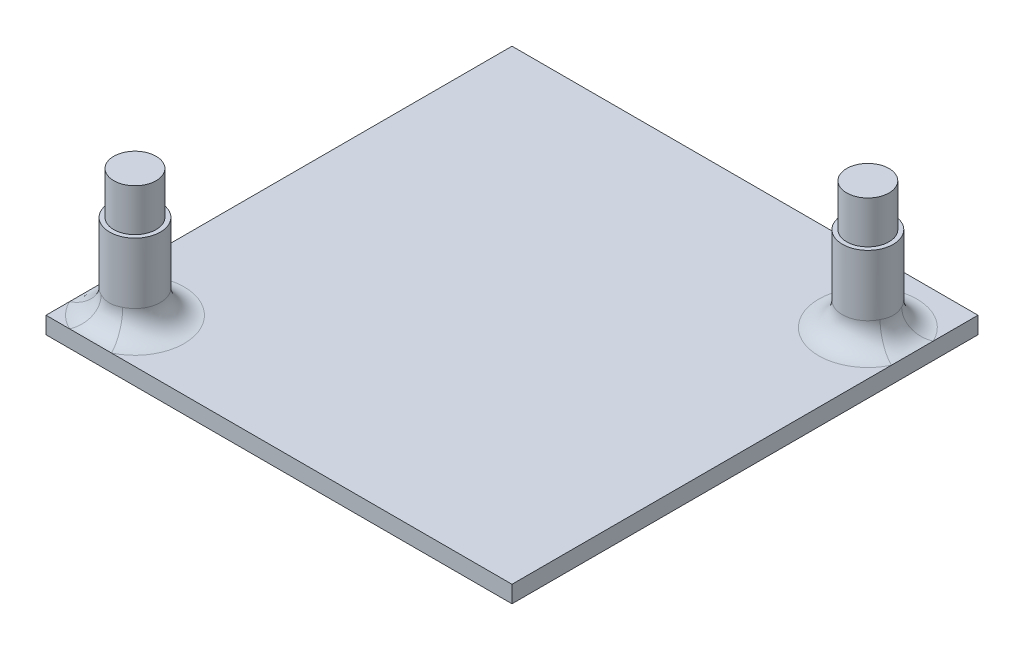
from build123d import *

# Parameters (mm, degrees)
SKETCH1_W           = 55
SKETCH1_H           = 55
BOSS_EXTRUDE1_DEPTH = 2
SKETCH2_R           = 3
BOSS_EXTRUDE2_DEPTH = 10
FILLET1_R           = 2.8
SKETCH3_R           = 2.5
BOSS_EXTRUDE3_DEPTH = 5


with BuildPart() as part:
    # Sketch1 → Boss-Extrude1 (new body)
    with BuildSketch(Plane(origin=(0, 0, 0), x_dir=(1, 0, 0), z_dir=(0, 1, 0))):
        Rectangle(SKETCH1_W, SKETCH1_H)
    extrude(amount=BOSS_EXTRUDE1_DEPTH)

    # Sketch2 → Boss-Extrude2 (add)
    with BuildSketch(Plane(origin=(0, 2, 0), x_dir=(1, 0, 0), z_dir=(0, 1, 0))):
        with Locations(Location((-22.25, -22.25, 0), (0, 0, 270))):
            Circle(SKETCH2_R)
        with Locations(Location((22.25, 19.75, 0), (0, 0, 270))):
            Circle(SKETCH2_R)
    extrude(amount=BOSS_EXTRUDE2_DEPTH)

    # Fillet1
    fillet1_edges = [part.edges().sort_by_distance(p)[0] for p in [
        (-22.25, 2, 19.25),
        (22.25, 2, -22.75),
    ]]
    fillet(fillet1_edges, radius=FILLET1_R)

    # Sketch3 → Boss-Extrude3 (add)
    with BuildSketch(Plane(origin=(0, 12, 0), x_dir=(1, 0, 0), z_dir=(0, 1, 0))):
        with Locations(Location((-22.25, -22.25, 0), (0, 0, 270))):
            Circle(SKETCH3_R)
        with Locations(Location((22.25, 19.75, 0), (0, 0, 270))):
            Circle(SKETCH3_R)
    extrude(amount=BOSS_EXTRUDE3_DEPTH)


solid = part.part
